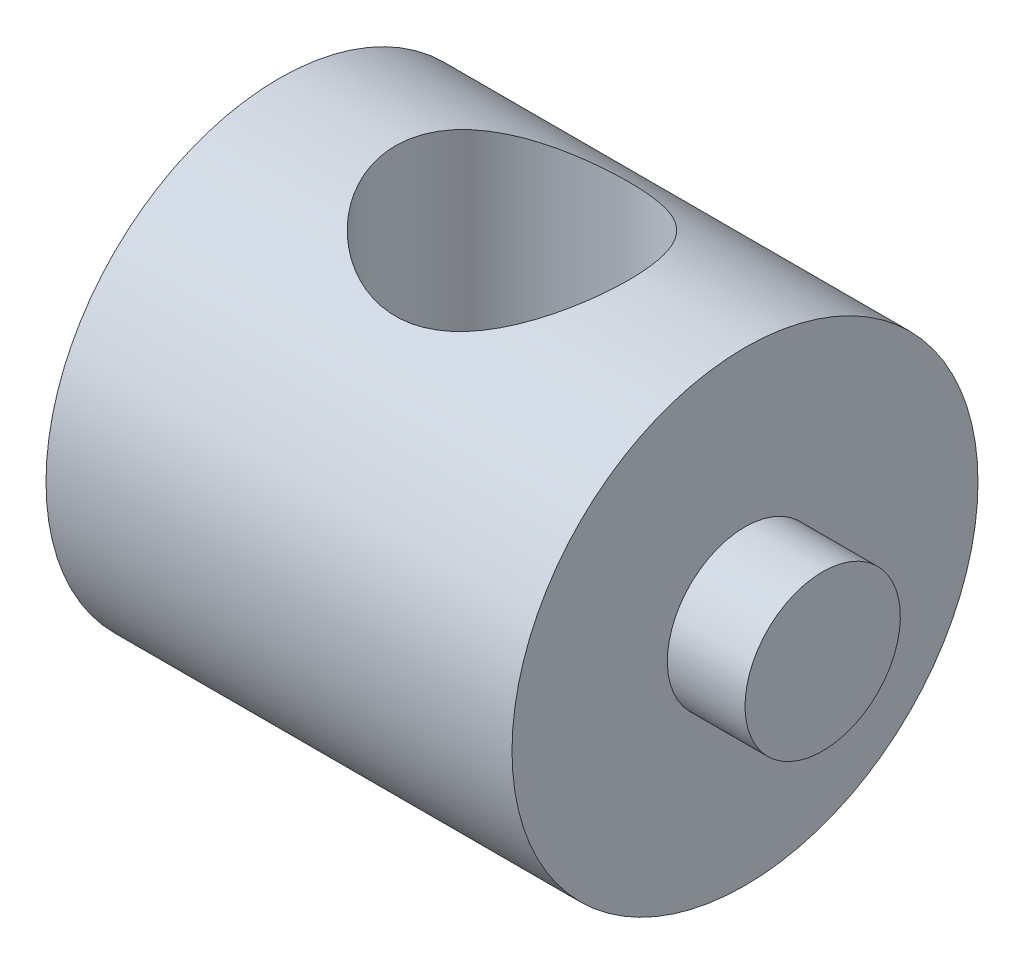
from build123d import *

# Parameters (mm, degrees)
SKETCH1_W               = 3.175
SKETCH1_H               = 3.175
CUT_EXTRUDE1_DEPTH      = 19.513272266
CUT_EXTRUDE1_DEPTH_BACK = 19.513272266
SKETCH2_R               = 4.7625


with BuildPart() as part:
    # Sketch1 → Revolve1 (revolve)
    with BuildSketch(Plane.XY):
        Polygon((-9.525, 0), (0, 0), (0, 9.525), (-9.525, 9.525), (-9.525, 3.175), align=None)
        Polygon((0, 9.525), (0, 0), (9.525, 0), (9.525, 3.175), (9.525, 9.525), align=None)
        with Locations((11.1125, 1.5875)):
            Rectangle(SKETCH1_W, SKETCH1_H)
        with Locations((-11.1125, 1.5875)):
            Rectangle(SKETCH1_W, SKETCH1_H)
    revolve(axis=Axis((12.7, 0, 0), (-1, 0, 0)))

    # Sketch2 → Cut-Extrude1 (cut, two sides: drawn at the far end of the back side and taken through both)
    with BuildSketch(Plane(origin=(0, 0, 0), x_dir=(1, 0, 0), z_dir=(0, 1, 0)).offset(-CUT_EXTRUDE1_DEPTH_BACK)):
        Circle(SKETCH2_R)
    extrude(amount=CUT_EXTRUDE1_DEPTH + CUT_EXTRUDE1_DEPTH_BACK, mode=Mode.SUBTRACT)


solid = part.part
